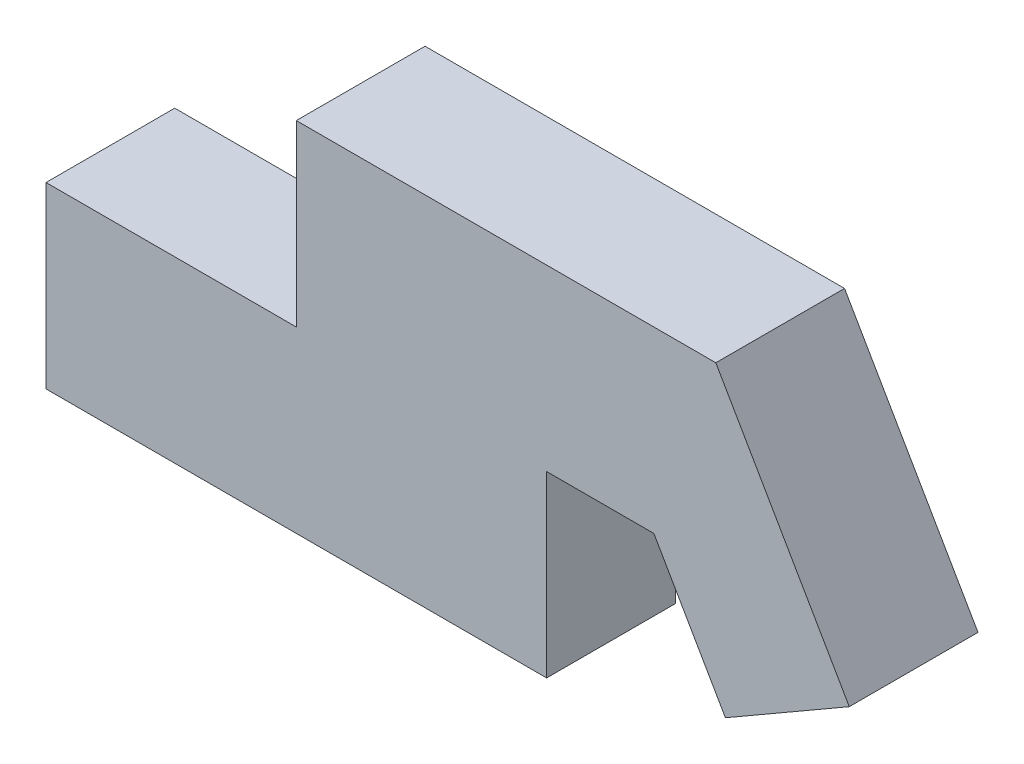
from build123d import *

# Parameters (mm, degrees)
RESSALTO_EXTRUS_O1_DEPTH = 18


with BuildPart() as part:
    # Esboço1 → Ressalto-extrusão1 (new body)
    with BuildSketch(Plane.XY):
        Polygon((70, 0), (70, 25), (85, 25), (95, 7.679491924), (112.320508076, 17.679491924), (93.660254038, 50), (35, 50), (35, 25), (0, 25), (0, 0), align=None)
    extrude(amount=RESSALTO_EXTRUS_O1_DEPTH)


solid = part.part
